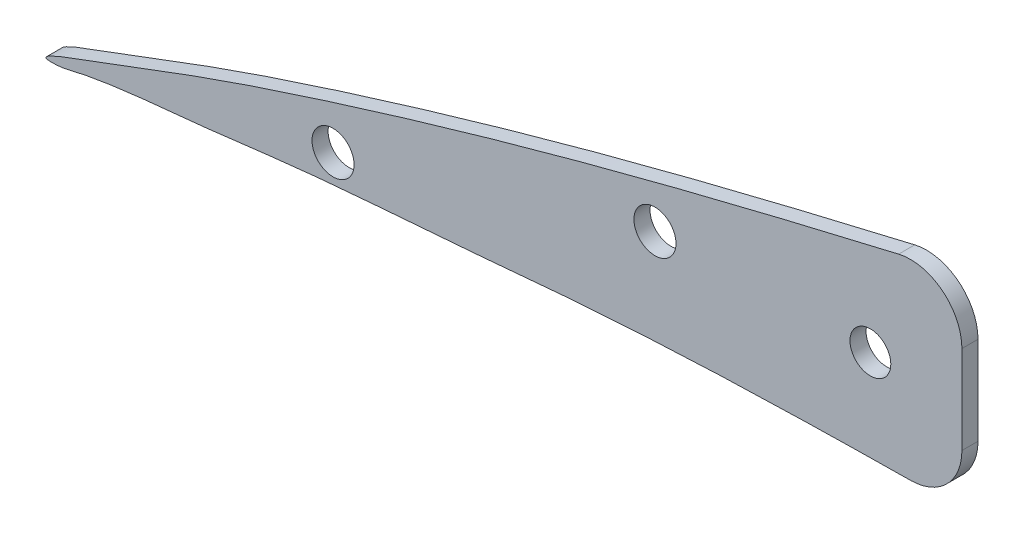
from build123d import *

# Parameters (mm, degrees)
BOSS_EXTRUDE1_DEPTH     = 226.06
CUT_EXTRUDE1_DEPTH      = 248.603669875
CUT_EXTRUDE1_DEPTH_BACK = 248.603669875
FILLET1_R               = 5.08
SKETCH4_W               = 41.117340127
SKETCH4_H               = 67.644656338
SKETCH4_W_2             = 211.282523513
SKETCH4_H_2             = 81.730555137
CUT_EXTRUDE5_DEPTH      = 246.233624371
SKETCH3_R               = 2.01295
CUT_EXTRUDE2_DEPTH      = 220.17283623
SKETCH5_R               = 2.075
CUT_EXTRUDE6_DEPTH      = 96.073271919


with BuildPart() as part:
    # Sketch1 → Boss-Extrude1 (new body)
    with BuildSketch(Plane.XY):
        with BuildLine():
            Line((99.32639085, 18.404394796), (99.32639085, -2.986448862))
            add(Edge.make_bspline(
                [(5.047603806, -9.653713384), (9.482649657, -8.546128483), (16.988483729, -8.076906091), (30.336595099, -6.254410192), (41.946659702, -5.566037344), (65.865842143, -3.231342143), (83.974811725, -3.089086557), (99.32639085, -2.986448862)],
                knots=[0, 0, 0, 0, 0.144322392, 0.237947652, 0.42712275, 0.512831912, 1, 1, 1, 1], degree=3))
            add(Edge.make_bspline(
                [(5.047603806, -9.653713384), (1.304537033, -10.042523479), (11.503328192, -6.353494655), (19.723627138, -3.092777487), (52.915151131, 7.645918304), (77.889766355, 13.460013374), (99.32639085, 18.404394796)],
                knots=[0, 0, 0, 0, 0.059914523, 0.175786391, 0.369274689, 1, 1, 1, 1], degree=3))
        make_face()
    extrude(amount=BOSS_EXTRUDE1_DEPTH)

    # Sketch2 → Cut-Extrude1 (cut, two sides: drawn at the far end of the back side and taken through both)
    with BuildSketch(Plane(origin=(0, 0, 0), x_dir=(1, 0, 0), z_dir=(0, 1, 0)).offset(-CUT_EXTRUDE1_DEPTH_BACK)):
        Polygon((169.681502528, 0), (169.681502528, -226.06), (73.16439085, -226.06), (73.16439085, -197.485), (93.73839085, -197.485), (93.73839085, -28.575), (73.16439085, -28.575), (73.16439085, 0), align=None)
    extrude(amount=CUT_EXTRUDE1_DEPTH + CUT_EXTRUDE1_DEPTH_BACK, mode=Mode.SUBTRACT)

    # Fillet1
    fillet1_edges = [part.edges().sort_by_distance(p)[0] for p in [
        (73.16439085, -3.388889971, 14.2875),
        (73.16439085, 12.236004014, 14.2875),
        (93.73839085, -3.026654485, 113.03),
        (93.73839085, 17.113551214, 113.03),
        (73.16439085, -3.388889971, 211.7725),
        (73.16439085, 12.236004014, 211.7725),
    ]]
    fillet(fillet1_edges, radius=FILLET1_R)

    # Sketch4 → Cut-Extrude5 (cut, through all)
    with BuildSketch(Plane(origin=(0, 0, 0), x_dir=(0, 0, -1), z_dir=(1, 0, 0))):
        with Locations((-218.043670064, 8.278534275)):
            Rectangle(SKETCH4_W, SKETCH4_H)
        with Locations((-90.256238244, 1.235584875)):
            Rectangle(SKETCH4_W_2, SKETCH4_H_2)
    extrude(amount=CUT_EXTRUDE5_DEPTH, mode=Mode.SUBTRACT)

    # Sketch3 → Cut-Extrude2 (cut, through all)
    with BuildSketch(Plane.XY):
        with Locations(Location((84.713563037, 5.874854857, 0), (0, 0, 180))):
            Circle(SKETCH3_R)
    extrude(amount=CUT_EXTRUDE2_DEPTH, mode=Mode.SUBTRACT)

    # Sketch5 → Cut-Extrude6 (cut, through all)
    with BuildSketch(Plane.XY.offset(197.485)):
        with Locations((31.717603806, -3.557713384)):
            Circle(SKETCH5_R)
        with Locations((63.467603806, 5.586286616)):
            Circle(SKETCH5_R)
    extrude(amount=-CUT_EXTRUDE6_DEPTH, mode=Mode.SUBTRACT)


solid = part.part
